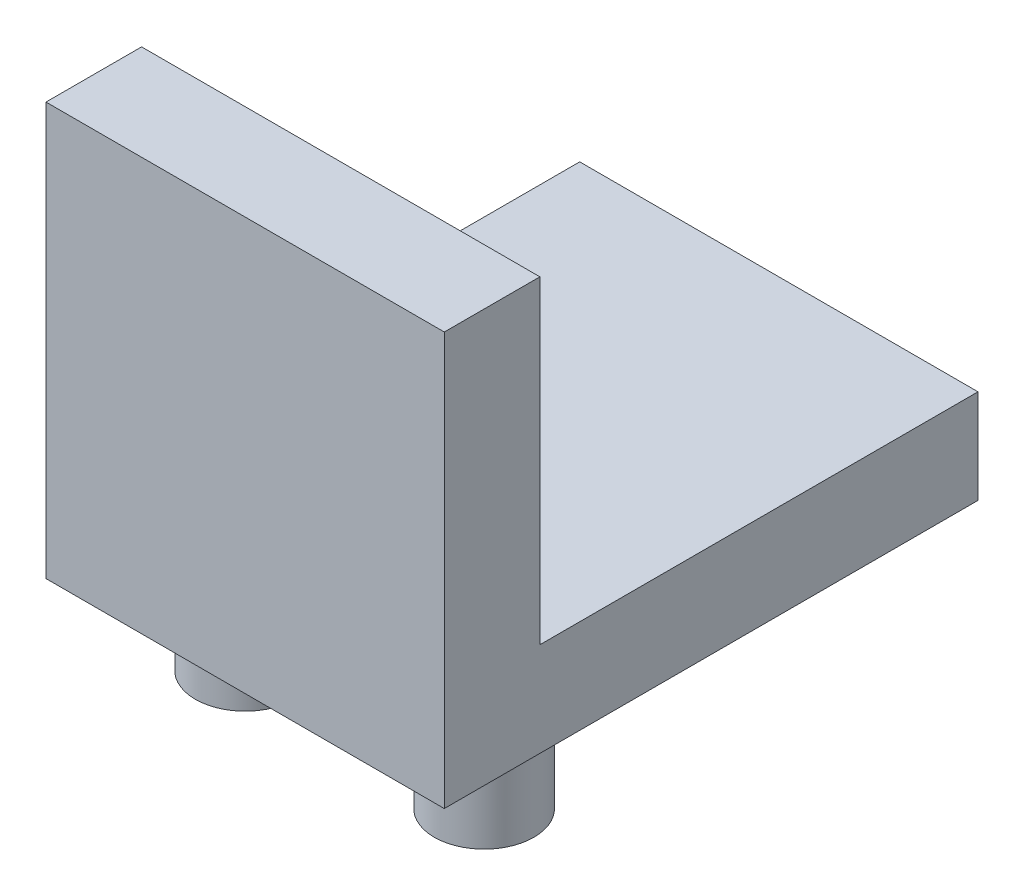
from build123d import *

# Parameters (mm, degrees)
SKETCH2_W           = 12.7
SKETCH2_H           = 6.858
BOSS_EXTRUDE1_DEPTH = 3
SKETCH3_R           = 1.5875
BOSS_EXTRUDE2_DEPTH = 3.175
SKETCH4_W           = 12.7
SKETCH4_H           = 3.81
BOSS_EXTRUDE3_DEPTH = 10.16
SKETCH8_W           = 12.7
SKETCH8_H           = 3
BOSS_EXTRUDE6_DEPTH = 10.16
SKETCH11_R          = 1.5875
BOSS_EXTRUDE7_DEPTH = 3.175
SKETCH12_W          = 12.7
SKETCH12_H          = 0.762
CUT_EXTRUDE1_DEPTH  = 10.16


with BuildPart() as part:
    # Sketch2 → Boss-Extrude1 (new body)
    with BuildSketch(Plane(origin=(0, 0, 0), x_dir=(1, 0, 0), z_dir=(0, 1, 0))):
        Rectangle(SKETCH2_W, SKETCH2_H)
    extrude(amount=BOSS_EXTRUDE1_DEPTH)

    # Sketch3 → Boss-Extrude2 (add)
    with BuildSketch(Plane.XZ):
        with Locations(Location((3.81, -0.381, 0), (0, 0, 90))):
            Circle(SKETCH3_R)
        with Locations(Location((-3.81, -0.381, 0), (0, 0, 90))):
            Circle(SKETCH3_R)
    extrude(amount=BOSS_EXTRUDE2_DEPTH)

    # Sketch4 → Boss-Extrude3 (add)
    with BuildSketch(Plane(origin=(0, 3, 0), x_dir=(1, 0, 0), z_dir=(0, 1, 0))):
        with Locations((0, -1.524)):
            Rectangle(SKETCH4_W, SKETCH4_H)
    extrude(amount=BOSS_EXTRUDE3_DEPTH)

    # Sketch8 → Boss-Extrude6 (add)
    with BuildSketch(Plane(origin=(0, 0, -3.429), x_dir=(-1, 0, 0), z_dir=(0, 0, -1))):
        with Locations((0, 1.5)):
            Rectangle(SKETCH8_W, SKETCH8_H)
    extrude(amount=BOSS_EXTRUDE6_DEPTH)

    # Sketch11 → Boss-Extrude7 (add)
    with BuildSketch(Plane.XZ):
        with Locations(Location((0, -8.001, 0), (0, 0, 90))):
            Circle(SKETCH11_R)
    extrude(amount=BOSS_EXTRUDE7_DEPTH)

    # Sketch12 → Cut-Extrude1 (cut)
    with BuildSketch(Plane(origin=(0, 13.16, 0), x_dir=(1, 0, 0), z_dir=(0, 1, 0))):
        Rectangle(SKETCH12_W, SKETCH12_H)
    extrude(amount=-CUT_EXTRUDE1_DEPTH, mode=Mode.SUBTRACT)


solid = part.part
